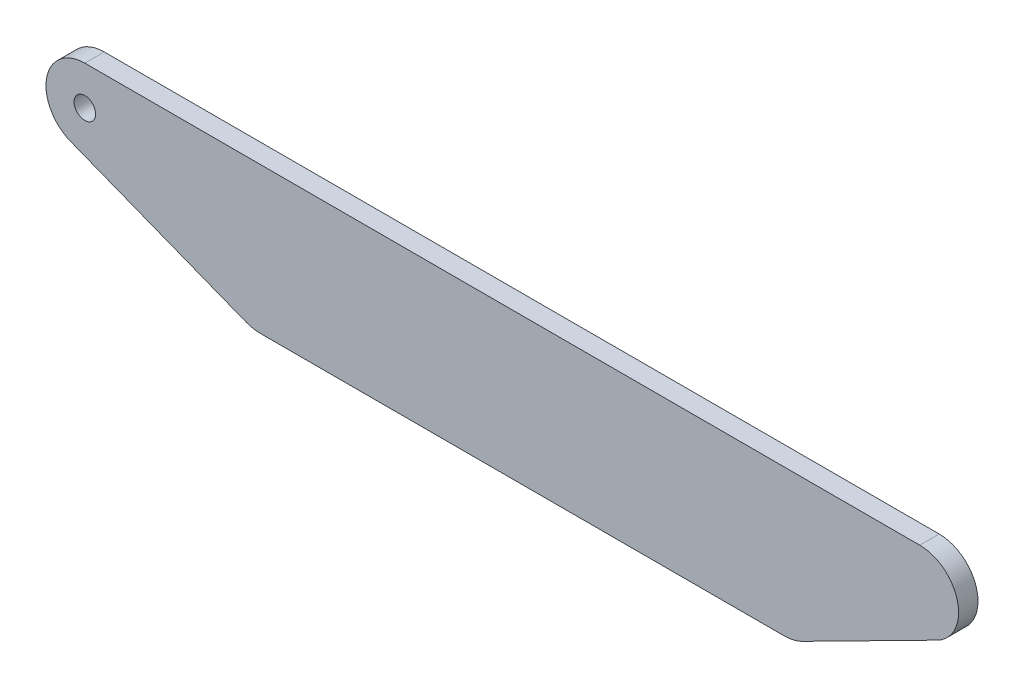
from build123d import *

# Parameters (mm, degrees)
SKETCH1_R           = 11.1125
BOSS_EXTRUDE1_DEPTH = 20


with BuildPart() as part:
    # Sketch1 → Boss-Extrude1 (new body)
    with BuildSketch(Plane.XY):
        with BuildLine():
            Line((-44.830525923, -428.048909173), (495.169474077, -428.048909173))
            ThreePointArc((495.169474077, -428.048909173), (504.478359134, -426.95063997), (513.276061103, -423.716142122))
            Line((513.276061103, -423.716142122), (652.565382984, -353.005464004))
            ThreePointArc((652.565382984, -353.005464004), (673.360526755, -308.029345997), (634.458795958, -277.338231054))
            Line((634.458795958, -277.338231054), (-225.541204042, -277.338231054))
            ThreePointArc((-225.541204042, -277.338231054), (-264.847657657, -309.921850251), (-240.116785444, -354.588095843))
            Line((-240.116785444, -354.588095843), (-59.406107325, -425.298773962))
            ThreePointArc((-59.406107325, -425.298773962), (-52.246906726, -427.355362788), (-44.830525923, -428.048909173))
        make_face()
        with Locations((-225.541204042, -317.338231054)):
            Circle(SKETCH1_R, mode=Mode.SUBTRACT)
    extrude(amount=BOSS_EXTRUDE1_DEPTH)


solid = part.part
